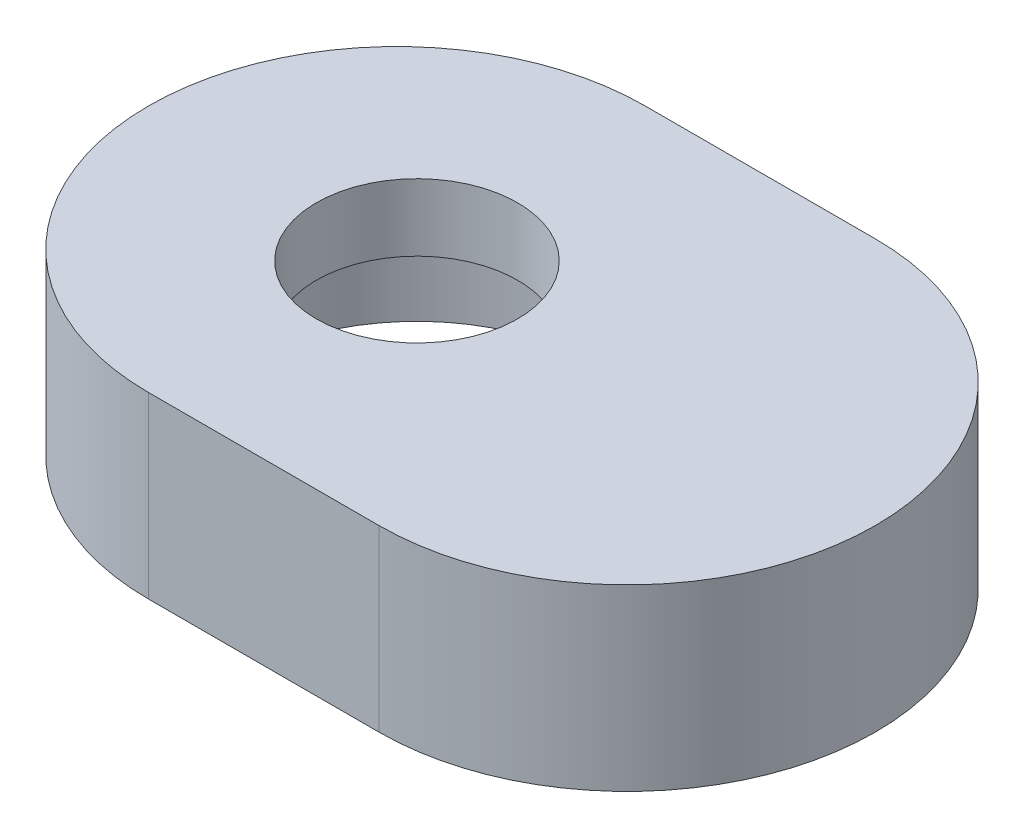
from build123d import *

# Parameters (mm, degrees)
SKETCH1_R           = 8
BOSS_EXTRUDE1_DEPTH = 8
SKETCH2_R           = 8.214701508
SKETCH2_R_2         = 4.5
BOSS_EXTRUDE2_DEPTH = 3


with BuildPart() as part:
    # Sketch1 → Boss-Extrude1 (new body)
    with BuildSketch(Plane(origin=(0, 0, 0), x_dir=(1, 0, 0), z_dir=(0, 1, 0))):
        with BuildLine():
            Line((-5.15, 11.1), (5.15, 11.1))
            ThreePointArc((5.15, 11.1), (16.25, 0), (5.15, -11.1))
            Line((5.15, -11.1), (-5.15, -11.1))
            ThreePointArc((-5.15, -11.1), (-16.25, 0), (-5.15, 11.1))
        make_face()
        with Locations(Location((-4.25, 0, 0), (0, 0, 270))):
            Circle(SKETCH1_R, mode=Mode.SUBTRACT)
    extrude(amount=BOSS_EXTRUDE1_DEPTH)

    # Sketch2 → Boss-Extrude2 (add)
    with BuildSketch(Plane(origin=(0, 8, 0), x_dir=(1, 0, 0), z_dir=(0, 1, 0))):
        with Locations((-4.25, 0)):
            Circle(SKETCH2_R)
        with Locations(Location((-4.25, 0, 0), (0, 0, 270))):
            Circle(SKETCH2_R_2, mode=Mode.SUBTRACT)
    extrude(amount=-BOSS_EXTRUDE2_DEPTH)


solid = part.part
